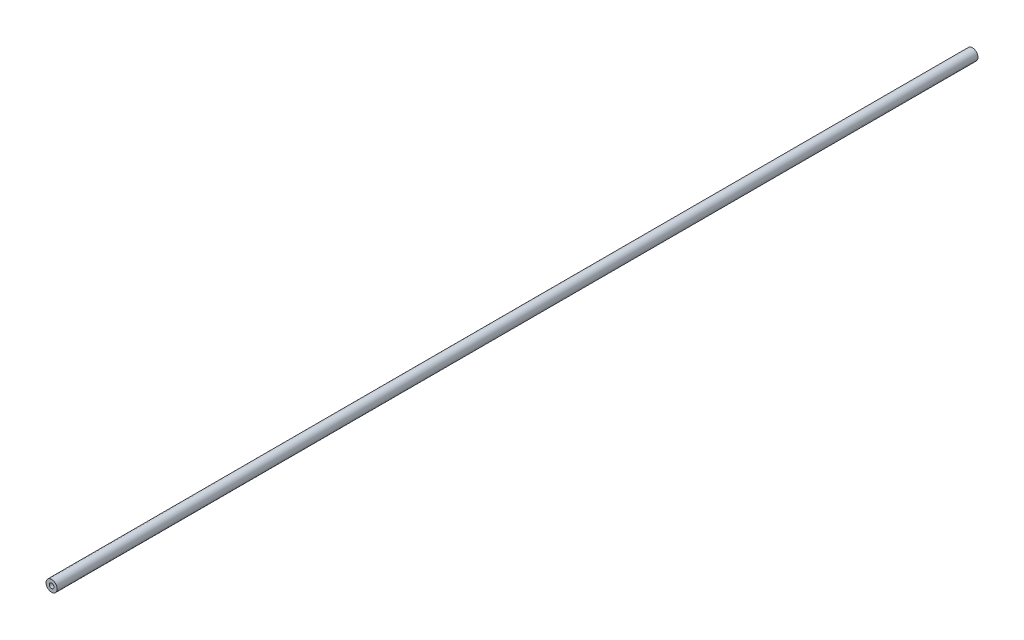
from build123d import *

# Parameters (mm, degrees)
SKETCH_1_R             = 6
EXTRUDE_1_DEPTH        = 495
HOLE_WIZARD_M6_1_D     = 5
HOLE_WIZARD_M6_1_DEPTH = 15
HOLE_WIZARD_M6_1_TIP   = 1.502151548
HOLE_WIZARD_M6_2_D     = 5
HOLE_WIZARD_M6_2_DEPTH = 15
HOLE_WIZARD_M6_2_TIP   = 1.502151548


with BuildPart() as part:
    # 草图1 → 凸台-拉伸1 (new, symmetric)
    with BuildSketch(Plane.XY):
        Circle(SKETCH_1_R)
    extrude(amount=EXTRUDE_1_DEPTH, both=True)

    # M6 螺纹孔1
    with Locations(Plane(origin=(0, 0, -495), x_dir=(-1, 0, 0), z_dir=(0, 0, -1))):
        with Locations((0, 0)):
            Hole(HOLE_WIZARD_M6_1_D / 2, depth=HOLE_WIZARD_M6_1_DEPTH)
            with Locations((0, 0, -(HOLE_WIZARD_M6_1_DEPTH + HOLE_WIZARD_M6_1_TIP / 2))):  # 118° drill point
                Cone(0, HOLE_WIZARD_M6_1_D / 2, HOLE_WIZARD_M6_1_TIP, mode=Mode.SUBTRACT)

    # M6 螺纹孔2
    with Locations(Plane.XY.offset(495)):
        with Locations((0, 0)):
            Hole(HOLE_WIZARD_M6_2_D / 2, depth=HOLE_WIZARD_M6_2_DEPTH)
            with Locations((0, 0, -(HOLE_WIZARD_M6_2_DEPTH + HOLE_WIZARD_M6_2_TIP / 2))):  # 118° drill point
                Cone(0, HOLE_WIZARD_M6_2_D / 2, HOLE_WIZARD_M6_2_TIP, mode=Mode.SUBTRACT)


solid = part.part
